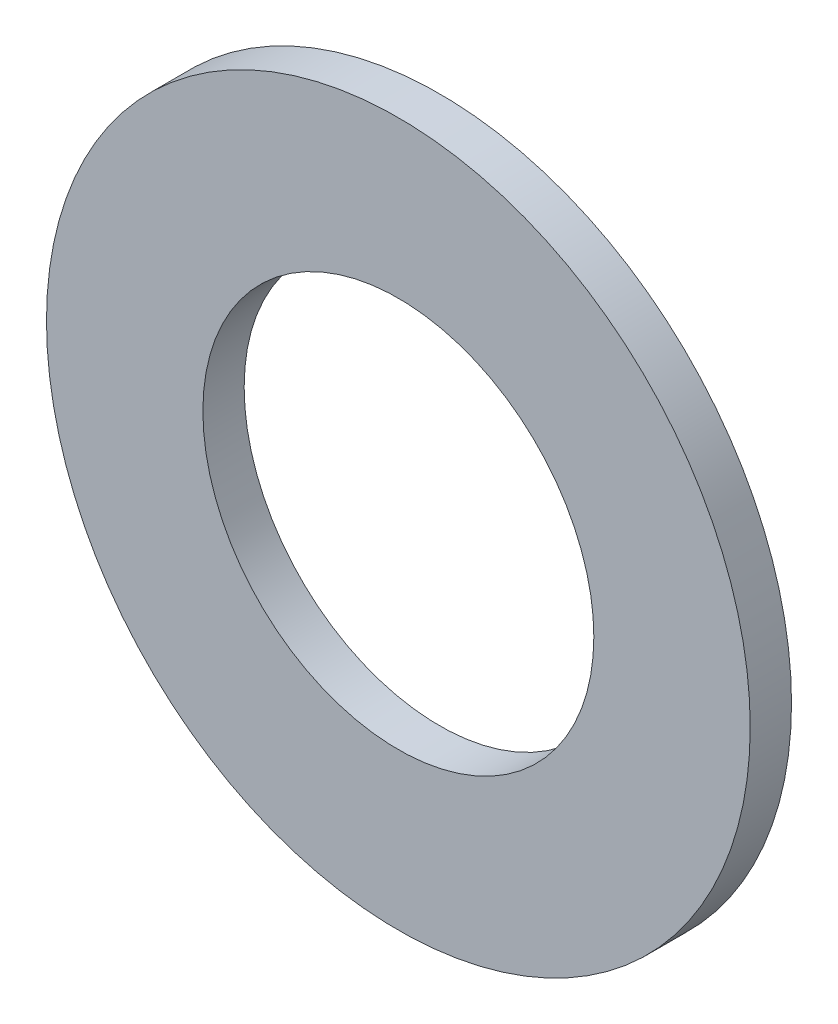
from build123d import *

# Parameters (mm, degrees)
SKETCH1_R           = 14.2875
SKETCH1_R_2         = 7.9375
BOSS_EXTRUDE1_DEPTH = 1.6764


with BuildPart() as part:
    # Sketch1 → Boss-Extrude1 (new body)
    with BuildSketch(Plane.XY):
        Circle(SKETCH1_R)
        Circle(SKETCH1_R_2, mode=Mode.SUBTRACT)
    extrude(amount=BOSS_EXTRUDE1_DEPTH)


solid = part.part
